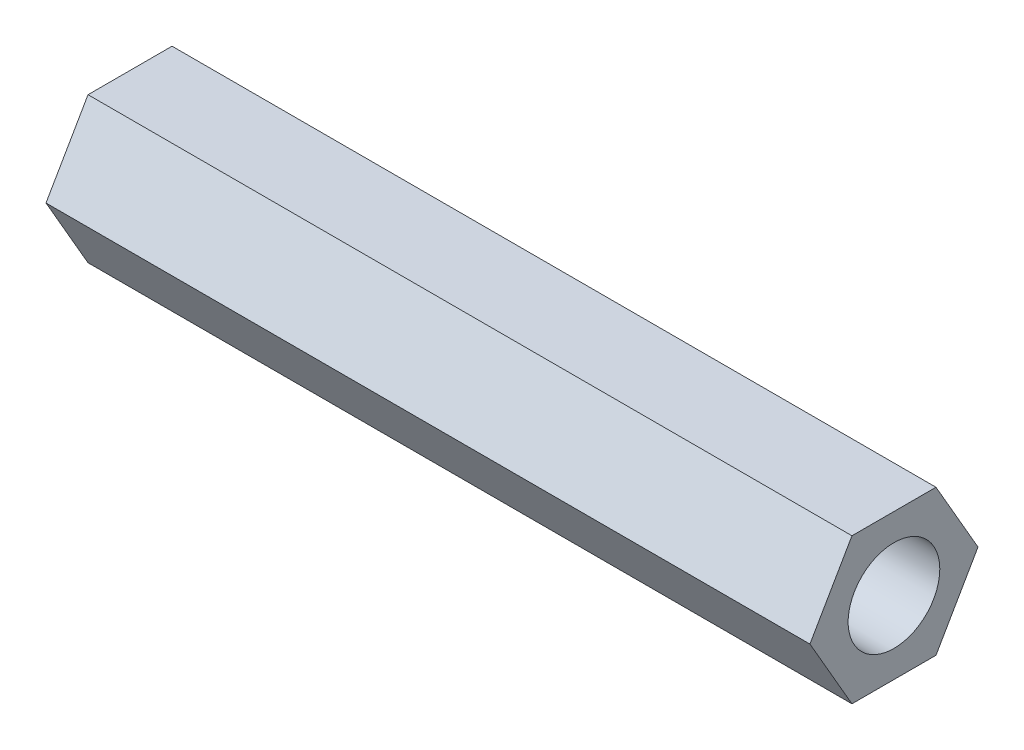
from build123d import *

# Parameters (mm, degrees)
SKETCH_1_R      = 1.5
EXTRUDE_1_DEPTH = 25


with BuildPart() as part:
    # 草图1 → 凸台-拉伸1 (new body)
    with BuildSketch(Plane(origin=(0, 0, 0), x_dir=(0, 0, -1), z_dir=(1, 0, 0))):
        Polygon((2.75, 0), (1.375, 2.38156986), (-1.375, 2.38156986), (-2.75, 0), (-1.375, -2.38156986), (1.375, -2.38156986), align=None)
        Circle(SKETCH_1_R, mode=Mode.SUBTRACT)
    extrude(amount=EXTRUDE_1_DEPTH)


solid = part.part
